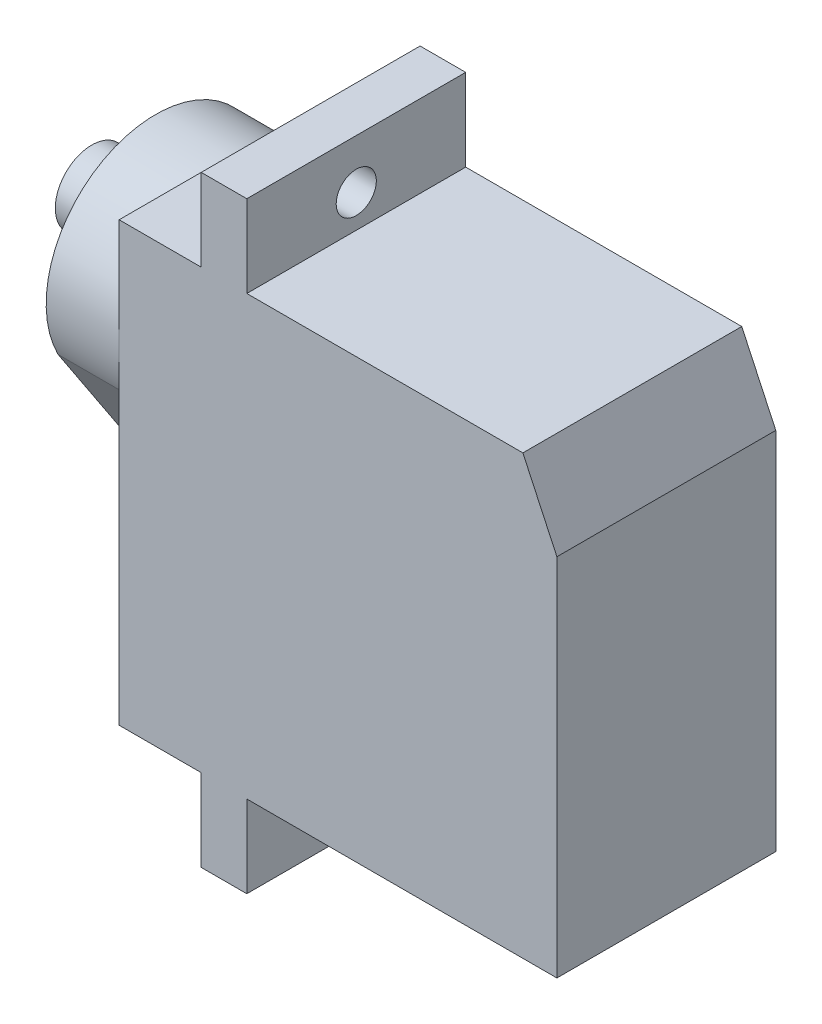
from build123d import *

# Parameters (mm, degrees)
EXTRUDE_1_DEPTH     = 12
SKETCH_3_R          = 1.1
CUT_EXTRUDE_1_DEPTH = 37.558172821
EXTRUDE_2_DEPTH     = 4
SKETCH_11_R         = 2
EXTRUDE_4_DEPTH     = 3.5
CHAMFER_1_SIZE      = 4
CHAMFER_1_SIZE2     = 1.865230633


with BuildPart() as part:
    # 草图1 → 凸台-拉伸1 (new body)
    with BuildSketch(Plane.XY):
        Polygon((7, 24), (7, 28.5), (4.5, 28.5), (4.5, 24), (0, 24), (0, 0), (4.5, 0), (4.5, -4.5), (7, -4.5), (7, 0), (24, 0), (24, 24), align=None)
    extrude(amount=EXTRUDE_1_DEPTH)

    # 草图3 → 切除-拉伸1 (cut, through all)
    with BuildSketch(Plane.ZY.offset(-4.5)):
        with Locations((6, 25.8)):
            Circle(SKETCH_3_R)
        with Locations((6, -1.8)):
            Circle(SKETCH_3_R)
    extrude(amount=-CUT_EXTRUDE_1_DEPTH, mode=Mode.SUBTRACT)

    # 草图10 → 凸台-拉伸2 (add)
    with BuildSketch(Plane.ZY):
        with BuildLine():
            Line((0.984839492, 14.706344723), (5.288002877, 8.154033308))
            ThreePointArc((5.288002877, 8.154033308), (6.054332561, 7.509929186), (6.714260792, 8.262674849))
            Line((6.714260792, 8.262674849), (11.347469324, 15.278865708))
            ThreePointArc((11.347469324, 15.278865708), (5.669013056, 23.990863681), (0.984839492, 14.706344723))
        make_face()
    extrude(amount=EXTRUDE_2_DEPTH)

    # 草图11 → 凸台-拉伸4 (add)
    with BuildSketch(Plane.ZY.offset(4)):
        with Locations((6, 18.8)):
            Circle(SKETCH_11_R)
    extrude(amount=EXTRUDE_4_DEPTH)

    # 倒角1
    chamfer_1_edges = [part.edges().sort_by_distance(p)[0] for p in [
        (24, 24, 6),
    ]]
    chamfer_1_side = [part.faces().sort_by_distance(p)[0] for p in [
        (24, 12, 6),
    ]]
    chamfer(chamfer_1_edges, length=CHAMFER_1_SIZE, length2=CHAMFER_1_SIZE2, reference=chamfer_1_side[0])


solid = part.part
